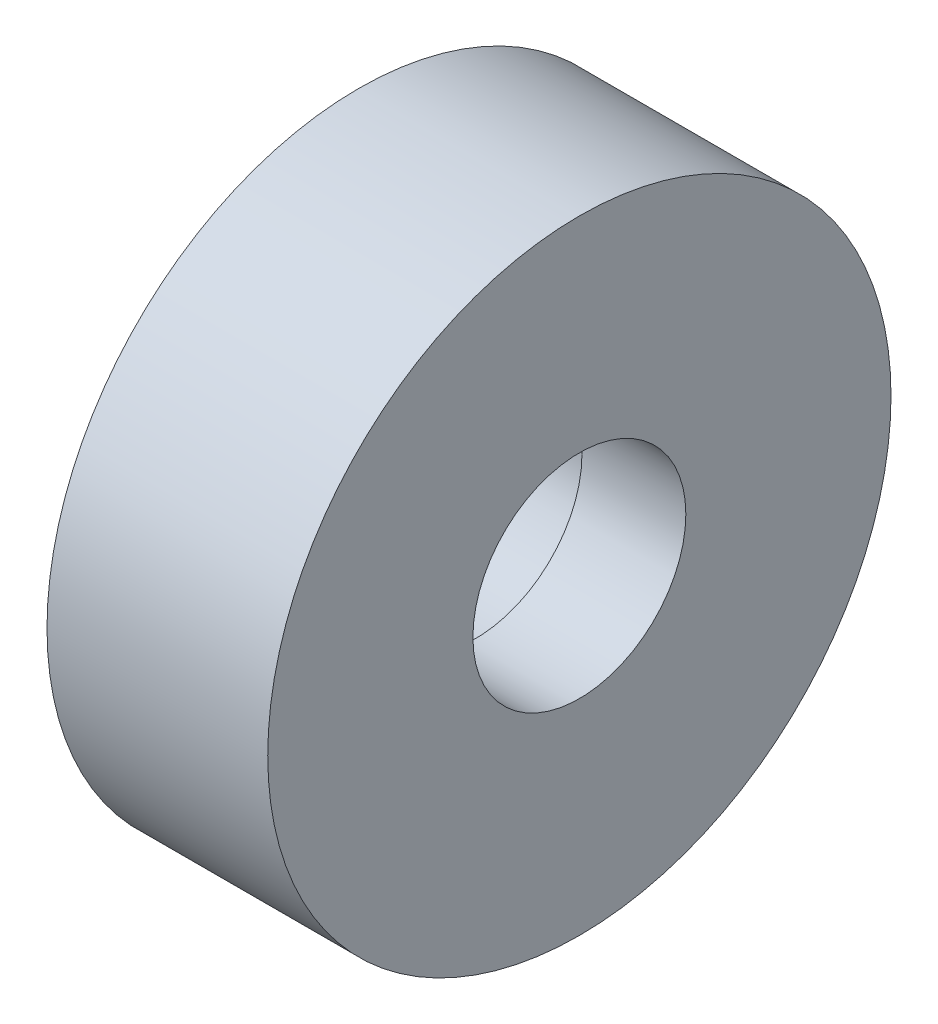
from build123d import *


with BuildPart() as part:
    # Sketch1 → Revolve1 (revolve)
    with BuildSketch(Plane.XY, mode=Mode.PRIVATE) as revolve1_sk:
        Polygon((-4.25, 12), (4.25, 12), (4.25, 4.1), (0.25, 4.1), (0.25, 4.15), (-4.25, 4.15), align=None)
    revolve(revolve1_sk.sketch.rotate(Axis((0, 0, 0), (1, 0, 0)), 90), axis=Axis((0, 0, 0), (1, 0, 0)))


solid = part.part
